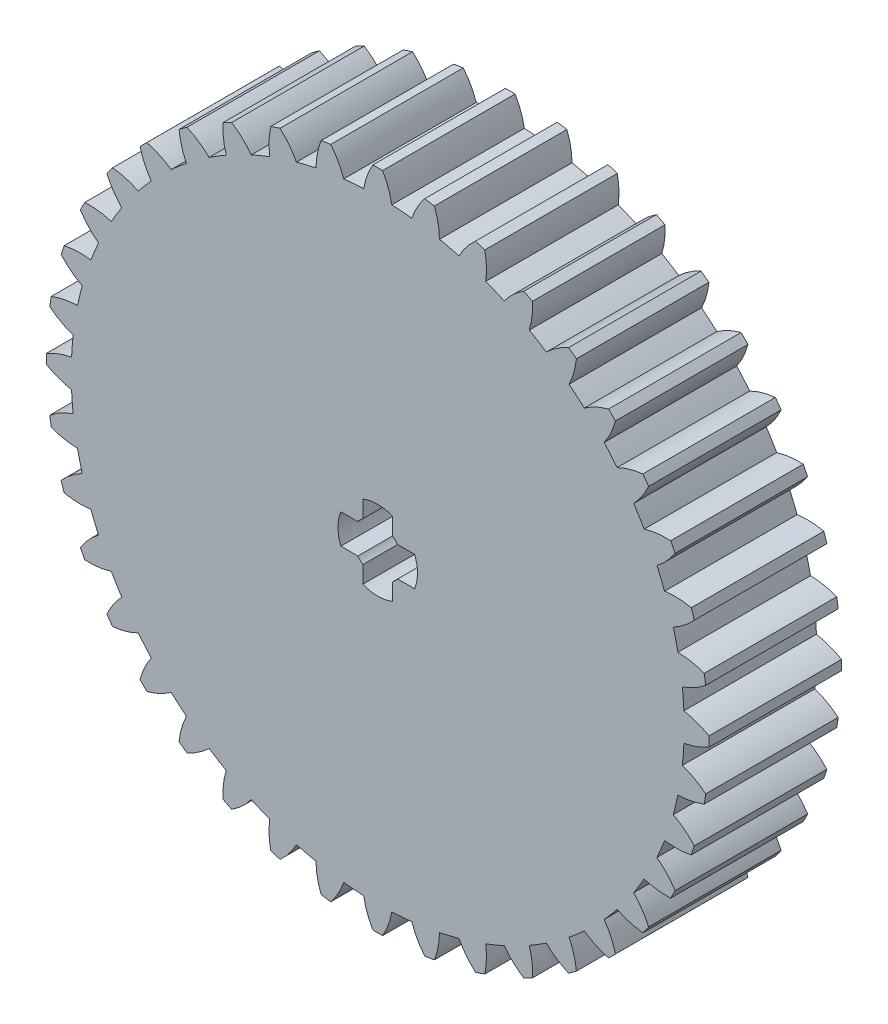
from build123d import *

# Parameters (mm, degrees)
SKETCH1_R           = 18.5
SKETCH1_R_2         = 1.5
BOSS_EXTRUDE1_DEPTH = 4
BOSS_EXTRUDE2_DEPTH = 8
CIRPATTERN2_COUNT   = 40
CUT_EXTRUDE1_DEPTH  = 10


with BuildPart() as part:
    # Sketch1 → Boss-Extrude1 (new, symmetric)
    with BuildSketch(Plane.XY):
        Circle(SKETCH1_R)
        Circle(SKETCH1_R_2, mode=Mode.SUBTRACT)
    extrude(amount=BOSS_EXTRUDE1_DEPTH, both=True)

    # Sketch3 → Boss-Extrude2 (add)
    with BuildSketch(Plane.XY.offset(4)):
        with BuildLine():
            ThreePointArc((0.848486756, 18.480532195), (0, 18.5), (-0.848486756, 18.480532195))
            add(Edge.make_bspline(
                [(-0.294921685, 19.997825412), (-0.708040355, 19.289863662), (-0.848486756, 18.480532195)],
                knots=[0, 0, 0, 1, 1, 1], degree=2))
            ThreePointArc((-0.294921685, 19.997825412), (0, 20), (0.294921685, 19.997825412))
            add(Edge.make_bspline(
                [(0.294921685, 19.997825412), (0.708040355, 19.289863662), (0.848486756, 18.480532195)],
                knots=[0, 0, 0, 1, 1, 1], degree=2))
        make_face()
    boss_extrude2 = extrude(amount=-BOSS_EXTRUDE2_DEPTH)

    # CirPattern2: Boss-Extrude2 ×40 about axis
    cirpattern2_axis = Axis((0, 0, 4), (0, 0, -1))
    for i in range(1, CIRPATTERN2_COUNT):
        add(boss_extrude2.rotate(cirpattern2_axis, i * 360 / CIRPATTERN2_COUNT))

    # Sketch4 → Cut-Extrude1 (cut)
    with BuildSketch(Plane.XY.offset(4)):
        with BuildLine():
            Line((-0.9, 2.224859546), (-0.9, 0.9))
            Line((-0.9, 0.9), (-2.224859546, 0.9))
            ThreePointArc((-2.224859546, 0.9), (-2.4, 0), (-2.224859546, -0.9))
            Line((-2.224859546, -0.9), (-0.9, -0.9))
            Line((-0.9, -0.9), (-0.9, -2.224859546))
            ThreePointArc((-0.9, -2.224859546), (0, -2.4), (0.9, -2.224859546))
            Line((0.9, -2.224859546), (0.9, -0.9))
            Line((0.9, -0.9), (2.224859546, -0.9))
            ThreePointArc((2.224859546, -0.9), (2.4, 0), (2.224859546, 0.9))
            Line((2.224859546, 0.9), (0.9, 0.9))
            Line((0.9, 0.9), (0.9, 2.224859546))
            ThreePointArc((0.9, 2.224859546), (0, 2.4), (-0.9, 2.224859546))
        make_face()
    extrude(amount=-CUT_EXTRUDE1_DEPTH, mode=Mode.SUBTRACT)


solid = part.part
